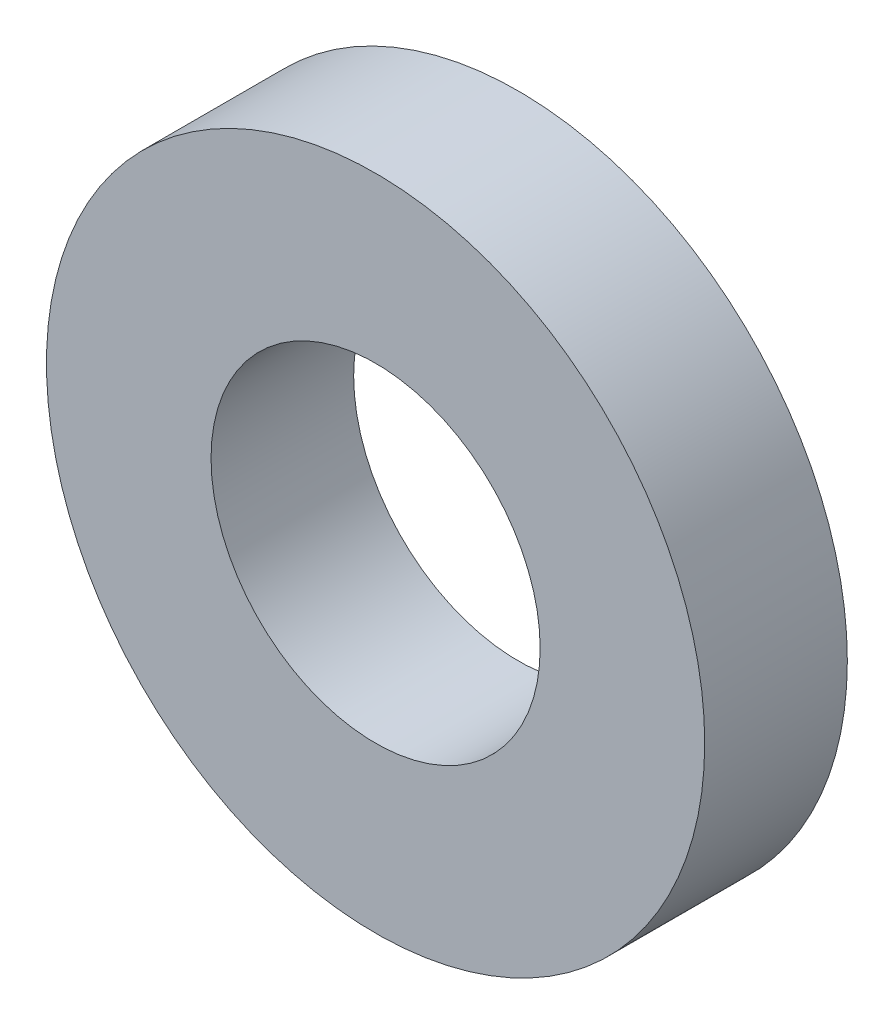
from build123d import *

# Parameters (mm, degrees)
SKETCH1_R           = 3
SKETCH1_R_2         = 1.5
BOSS_EXTRUDE1_DEPTH = 0.65


with BuildPart() as part:
    # Sketch1 → Boss-Extrude1 (new, symmetric)
    with BuildSketch(Plane.XY):
        Circle(SKETCH1_R)
        Circle(SKETCH1_R_2, mode=Mode.SUBTRACT)
    extrude(amount=BOSS_EXTRUDE1_DEPTH, both=True)


solid = part.part
